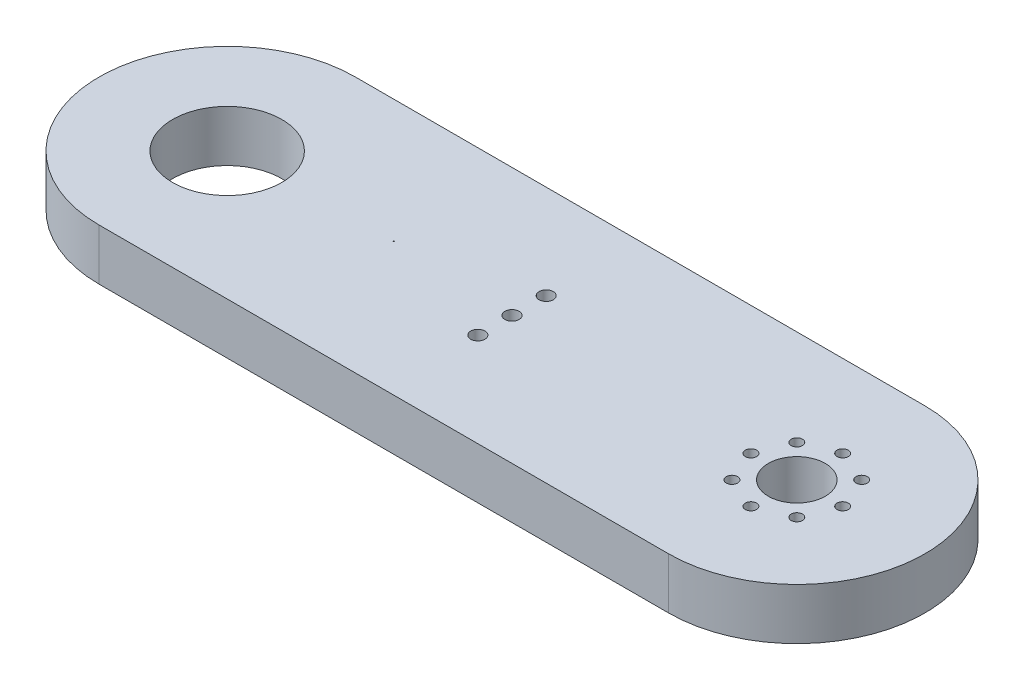
from build123d import *

# Parameters (mm, degrees)
BOSS_EXTRUDE1_DEPTH          = 4.5
CUT_EXTRUDE1_DEPTH           = 77.442789065
CUT_EXTRUDE1_DEPTH_BACK      = 77.442789065
SKETCH3_R                    = 0.99
SKETCH4_R                    = 5
CUT_EXTRUDE2_DEPTH           = 77.442789065
CUT_EXTRUDE3_DEPTH           = 77.442789065
CUT_EXTRUDE3_DEPTH_BACK      = 77.442789065
SKETCH5_R                    = 1.25
CUT_EXTRUDE4_DEPTH           = 77.442789065
CUT_EXTRUDE4_DEPTH_BACK      = 77.442789065
SKETCH6_R                    = 9.591798866
F_97_0_0059_DIAMETER_HOLE1_D = 0.14986


with BuildPart() as part:
    # Sketch2 → Boss-Extrude1 (new, symmetric)
    with BuildSketch(Plane(origin=(0, 0, 0), x_dir=(1, 0, 0), z_dir=(0, 1, 0))):
        with BuildLine():
            Line((50, -22.5), (-50, -22.5))
            ThreePointArc((-50, -22.5), (-72.5, 0), (-50, 22.5))
            Line((-50, 22.5), (50, 22.5))
            ThreePointArc((50, 22.5), (72.5, 0), (50, -22.5))
        make_face()
    extrude(amount=BOSS_EXTRUDE1_DEPTH, both=True)

    # Sketch3 → Cut-Extrude1 (cut, two sides: drawn at the far end of the back side and taken through both)
    with BuildSketch(Plane(origin=(0, 4.5, 0), x_dir=(1, 0, 0), z_dir=(0, 1, 0)).offset(-CUT_EXTRUDE1_DEPTH_BACK)):
        with Locations(Location((41.95, 0, 0), (0, 0, 270))):
            Circle(SKETCH3_R)
        with Locations(Location((44.307790411, 5.692209589, 0), (0, 0, 270))):
            Circle(SKETCH3_R)
        with Locations(Location((50, 8.05, 0), (0, 0, 270))):
            Circle(SKETCH3_R)
        with Locations(Location((55.692209589, 5.692209589, 0), (0, 0, 270))):
            Circle(SKETCH3_R)
        with Locations(Location((58.05, 0, 0), (0, 0, 270))):
            Circle(SKETCH3_R)
        with Locations(Location((55.692209589, -5.692209589, 0), (0, 0, 270))):
            Circle(SKETCH3_R)
        with Locations(Location((50, -8.05, 0), (0, 0, 270))):
            Circle(SKETCH3_R)
        with Locations(Location((44.307790411, -5.692209589, 0), (0, 0, 270))):
            Circle(SKETCH3_R)
    extrude(amount=CUT_EXTRUDE1_DEPTH + CUT_EXTRUDE1_DEPTH_BACK, mode=Mode.SUBTRACT)

    # Sketch4 → Cut-Extrude2 (cut, through all)
    with BuildSketch(Plane(origin=(0, 4.5, 0), x_dir=(1, 0, 0), z_dir=(0, 1, 0))):
        with Locations(Location((50, 0, 0), (0, 0, 270))):
            Circle(SKETCH4_R)
    extrude(amount=-CUT_EXTRUDE2_DEPTH, mode=Mode.SUBTRACT)

    # Sketch5 → Cut-Extrude3 (cut, two sides: drawn at the far end of the back side and taken through both)
    with BuildSketch(Plane(origin=(0, 4.5, 0), x_dir=(1, 0, 0), z_dir=(0, 1, 0)).offset(-CUT_EXTRUDE3_DEPTH_BACK)):
        with Locations(Location((0, 6, 0), (0, 0, 270))):
            Circle(SKETCH5_R)
        with Locations(Location((0, 0, 0), (0, 0, 270))):
            Circle(SKETCH5_R)
        with Locations(Location((0, -6, 0), (0, 0, 270))):
            Circle(SKETCH5_R)
    extrude(amount=CUT_EXTRUDE3_DEPTH + CUT_EXTRUDE3_DEPTH_BACK, mode=Mode.SUBTRACT)

    # Sketch6 → Cut-Extrude4 (cut, two sides: drawn at the far end of the back side and taken through both)
    with BuildSketch(Plane(origin=(0, 4.5, 0), x_dir=(1, 0, 0), z_dir=(0, 1, 0)).offset(-CUT_EXTRUDE4_DEPTH_BACK)):
        with Locations(Location((-50, 0, 0), (0, 0, 270))):
            Circle(SKETCH6_R)
    extrude(amount=CUT_EXTRUDE4_DEPTH + CUT_EXTRUDE4_DEPTH_BACK, mode=Mode.SUBTRACT)

    # #97 (0.0059) Diameter Hole1 (through all)
    with Locations(Plane(origin=(-21.665942964, -4.5, -0.906896611), x_dir=(0, 0, -1), z_dir=(0, -1, 0))):
        with Locations((0, 0)):
            Hole(F_97_0_0059_DIAMETER_HOLE1_D / 2)


solid = part.part
